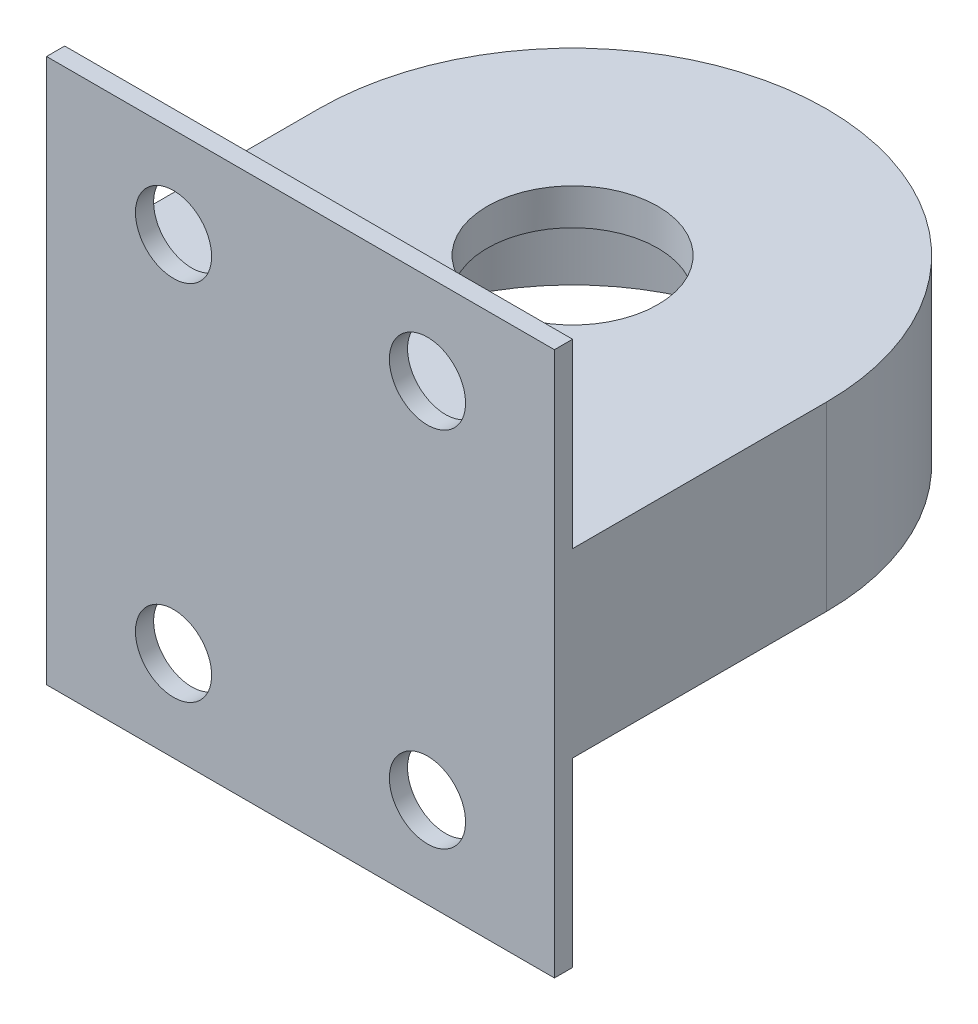
from build123d import *

# Parameters (mm, degrees)
SKETCH1_R                   = 4.7
BOSS_EXTRUDE1_DEPTH         = 10
SKETCH2_W                   = 28
SKETCH2_H                   = 30
BOSS_EXTRUDE2_DEPTH         = 1
TAP_DRILL_FOR_M5X0_8_TAP1_D = 4.2
SKETCH5_R                   = 12.15
SKETCH5_R_2                 = 4.7
CUT_EXTRUDE1_DEPTH          = 8


with BuildPart() as part:
    # Sketch1 → Boss-Extrude1 (new body)
    with BuildSketch(Plane(origin=(0, 0, 0), x_dir=(1, 0, 0), z_dir=(0, 1, 0))):
        with BuildLine():
            Line((0, 1.238241861), (0, 15.238241861))
            ThreePointArc((0, 15.238241861), (-14, 29.238241861), (-28, 15.238241861))
            Line((-28, 15.238241861), (-28, 1.238241861))
            Line((-28, 1.238241861), (0, 1.238241861))
        make_face()
        with Locations((-14, 15.238241861)):
            Circle(SKETCH1_R, mode=Mode.SUBTRACT)
    extrude(amount=BOSS_EXTRUDE1_DEPTH)

    # Sketch2 → Boss-Extrude2 (add)
    with BuildSketch(Plane.XY.offset(-1.238241861)):
        with Locations((-14, 5)):
            Rectangle(SKETCH2_W, SKETCH2_H)
    extrude(amount=BOSS_EXTRUDE2_DEPTH)

    # Tap Drill for M5x0.8 Tap1 (through all)
    with Locations(Plane(origin=(0, 0, -1.238241861), x_dir=(-1, 0, 0), z_dir=(0, 0, -1))):
        with Locations((7, 15), (21, 15), (7, -5), (21, -5)):
            Hole(TAP_DRILL_FOR_M5X0_8_TAP1_D / 2)

    # Sketch5 → Cut-Extrude1 (cut)
    with BuildSketch(Plane.XZ):
        with Locations((-14, -15.238241861)):
            Circle(SKETCH5_R)
        with Locations((-14, -15.238241861)):
            Circle(SKETCH5_R_2, mode=Mode.SUBTRACT)
    extrude(amount=-CUT_EXTRUDE1_DEPTH, mode=Mode.SUBTRACT)


solid = part.part
